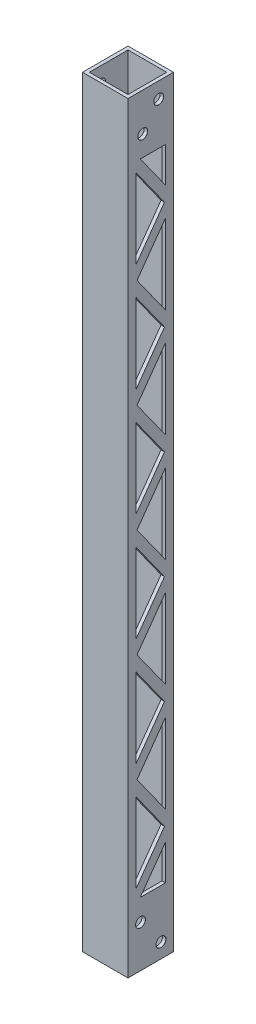
from build123d import *

# Parameters (mm, degrees)
BOSS_EXTRUDE1_START           = 11.873397
SKETCH2_W                     = 20
SKETCH2_H                     = 20
SKETCH2_W_2                   = 17
SKETCH2_H_2                   = 17
BOSS_EXTRUDE1_DEPTH           = 335.093577
M4_CLEARANCE_HOLE1_AT_2_COUNT = 2
M4_CLEARANCE_HOLE1_AT_2_PITCH = 12
M4_CLEARANCE_HOLE2_AT_2_COUNT = 2
M4_CLEARANCE_HOLE2_AT_2_PITCH = 12
M4_CLEARANCE_HOLE3_AT_2_COUNT = 2
M4_CLEARANCE_HOLE3_AT_2_PITCH = 14.999999999
M4_CLEARANCE_HOLE4_AT_2_COUNT = 2
M4_CLEARANCE_HOLE4_AT_2_PITCH = 14.999999999
CUT_EXTRUDE1_DEPTH            = 324.529418692
CUT_EXTRUDE1_DEPTH_BACK       = 324.529418692


with BuildPart() as part:
    # Sketch2 → Boss-Extrude1 (new body)
    with BuildSketch(Plane(origin=(0, 0, 0), x_dir=(1, 0, 0), z_dir=(0, 1, 0)).offset(BOSS_EXTRUDE1_START)):
        Rectangle(SKETCH2_W, SKETCH2_H)
        Rectangle(SKETCH2_W_2, SKETCH2_H_2, mode=Mode.SUBTRACT)
    extrude(amount=-BOSS_EXTRUDE1_DEPTH)

    # Sketch5 → M4 Clearance Hole1 (revolve, cut)
    with BuildSketch(Plane(origin=(-10, 4.873397172, 3.5), x_dir=(0, 0, 1), z_dir=(0, 1, 0))):
        Polygon((0, 0), (0, 1.5), (2.15, 1.5), (2.15, 0.025), (2.175, 0), align=None)
    m4_clearance_hole1 = revolve(axis=Axis((-16.35, 4.873397172, 3.5), (1, 0, 0)), mode=Mode.SUBTRACT)

    # M4 Clearance Hole1 at 2: M4 Clearance Hole1 ×2
    with Locations(*[Vector(0, -0.8122328620674136, -0.5833333333333335) * (i * M4_CLEARANCE_HOLE1_AT_2_PITCH) for i in range(1, M4_CLEARANCE_HOLE1_AT_2_COUNT)]):
        add(m4_clearance_hole1, mode=Mode.SUBTRACT)

    # Sketch8 → M4 Clearance Hole2 (revolve, cut)
    with BuildSketch(Plane(origin=(10, 4.873397172, -3.5), x_dir=(0, 0, -1), z_dir=(0, 1, 0))):
        Polygon((0, 0), (0, 1.5), (2.15, 1.5), (2.15, 0.025), (2.175, 0), align=None)
    m4_clearance_hole2 = revolve(axis=Axis((16.35, 4.873397172, -3.5), (-1, 0, 0)), mode=Mode.SUBTRACT)

    # M4 Clearance Hole2 at 2: M4 Clearance Hole2 ×2
    with Locations(*[Vector(0, -0.8122328620674134, 0.5833333333333337) * (i * M4_CLEARANCE_HOLE2_AT_2_PITCH) for i in range(1, M4_CLEARANCE_HOLE2_AT_2_COUNT)]):
        add(m4_clearance_hole2, mode=Mode.SUBTRACT)

    # Sketch10 → M4 Clearance Hole3 (revolve, cut)
    with BuildSketch(Plane(origin=(-10, -304.720180379, -4.5), x_dir=(0, 0, 1), z_dir=(0, 1, 0))):
        Polygon((0, 0), (0, 1.5), (2.15, 1.5), (2.15, 0.025), (2.175, 0), align=None)
    m4_clearance_hole3 = revolve(axis=Axis((-16.35, -304.720180379, -4.5), (1, 0, 0)), mode=Mode.SUBTRACT)

    # M4 Clearance Hole3 at 2: M4 Clearance Hole3 ×2
    with Locations(*[Vector(0, -0.7999999999715266, 0.6000000000379647) * (i * M4_CLEARANCE_HOLE3_AT_2_PITCH) for i in range(1, M4_CLEARANCE_HOLE3_AT_2_COUNT)]):
        add(m4_clearance_hole3, mode=Mode.SUBTRACT)

    # Sketch12 → M4 Clearance Hole4 (revolve, cut)
    with BuildSketch(Plane(origin=(10, -304.720180379, 4.5), x_dir=(0, 0, -1), z_dir=(0, 1, 0))):
        Polygon((0, 0), (0, 1.5), (2.15, 1.5), (2.15, 0.025), (2.175, 0), align=None)
    m4_clearance_hole4 = revolve(axis=Axis((16.35, -304.720180379, 4.5), (-1, 0, 0)), mode=Mode.SUBTRACT)

    # M4 Clearance Hole4 at 2: M4 Clearance Hole4 ×2
    with Locations(*[Vector(0, -0.7999999999715265, -0.6000000000379647) * (i * M4_CLEARANCE_HOLE4_AT_2_PITCH) for i in range(1, M4_CLEARANCE_HOLE4_AT_2_COUNT)]):
        add(m4_clearance_hole4, mode=Mode.SUBTRACT)

    # Sketch13 → Cut-Extrude1 (cut, two sides: drawn at the far end of the back side and taken through both)
    with BuildSketch(Plane(origin=(0, 0, 0), x_dir=(0, 0, -1), z_dir=(1, 0, 0)).offset(-CUT_EXTRUDE1_DEPTH_BACK)):
        Polygon((6.5, -279.677709563), (-4.611616577, -295.220180379), (6.5, -295.220180379), align=None)
        Polygon((-6.5, -255.898810962), (6.04145572, -273.441281778), (-6.5, -290.983752595), align=None)
        Polygon((6.5, -232.119912362), (-6.04145572, -249.662383178), (6.5, -267.204853994), align=None)
        Polygon((-6.5, -208.341013761), (6.04145572, -225.883484577), (-6.5, -243.425955393), align=None)
        Polygon((6.5, -184.56211516), (-6.04145572, -202.104585977), (6.5, -219.647056793), align=None)
        Polygon((-6.5, -160.78321656), (6.04145572, -178.325687376), (-6.5, -195.868158192), align=None)
        Polygon((6.5, -137.004317959), (-6.04145572, -154.546788776), (6.5, -172.089259592), align=None)
        Polygon((-6.5, -113.225419359), (6.04145572, -130.767890175), (-6.5, -148.310360991), align=None)
        Polygon((6.5, -89.446520758), (-6.04145572, -106.988991575), (6.5, -124.531462391), align=None)
        Polygon((-6.5, -65.667622158), (6.04145572, -83.210092974), (-6.5, -100.75256379), align=None)
        Polygon((-6.04145572, -59.431194373), (6.5, -76.97366519), (6.5, -41.888723557), align=None)
        Polygon((-6.5, -18.109824957), (6.04145572, -35.652295773), (-6.5, -53.194766589), align=None)
        Polygon((6.5, -13.873397172), (6.5, -29.415867989), (-4.611616577, -13.873397172), align=None)
    extrude(amount=CUT_EXTRUDE1_DEPTH + CUT_EXTRUDE1_DEPTH_BACK, mode=Mode.SUBTRACT)


solid = part.part
